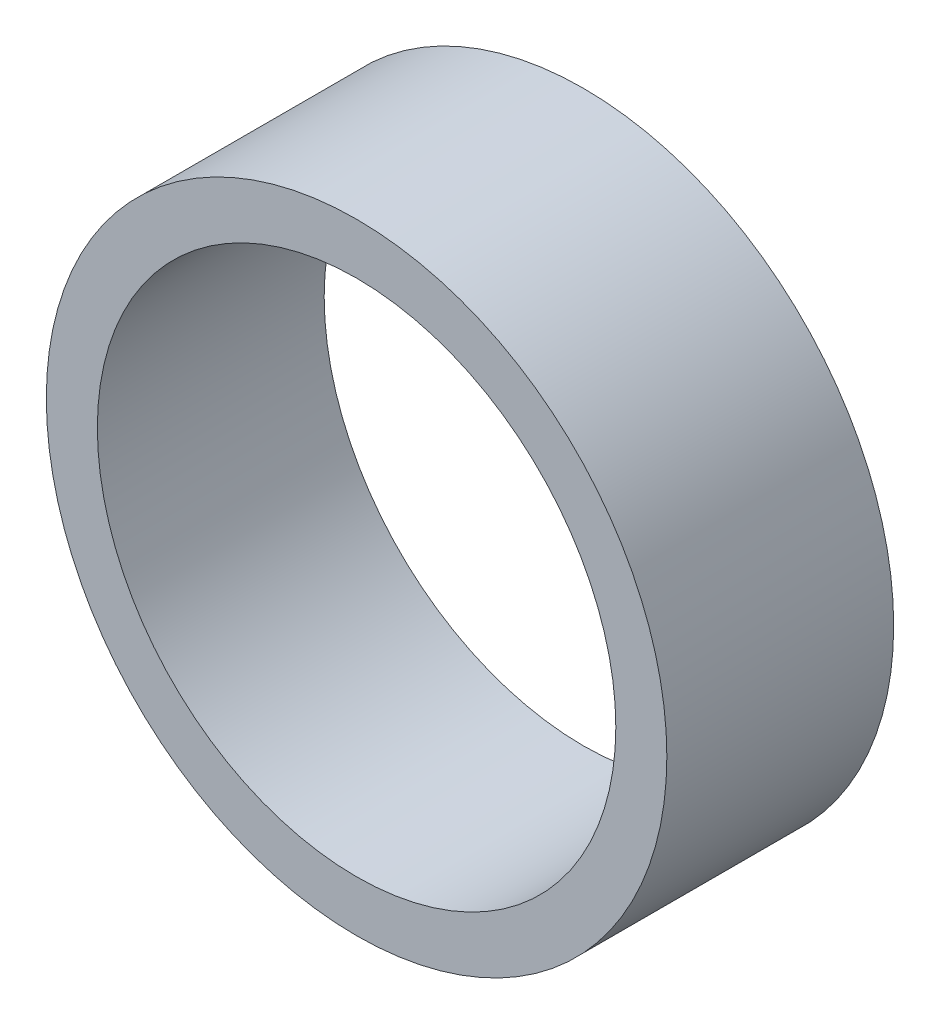
from build123d import *

# Parameters (mm, degrees)
SKETCH1_R           = 24.3205
SKETCH1_R_2         = 20.32
BOSS_EXTRUDE1_DEPTH = 17.78


with BuildPart() as part:
    # Sketch1 → Boss-Extrude1 (new body)
    with BuildSketch(Plane.XY):
        Circle(SKETCH1_R)
        Circle(SKETCH1_R_2, mode=Mode.SUBTRACT)
    extrude(amount=BOSS_EXTRUDE1_DEPTH)


solid = part.part
